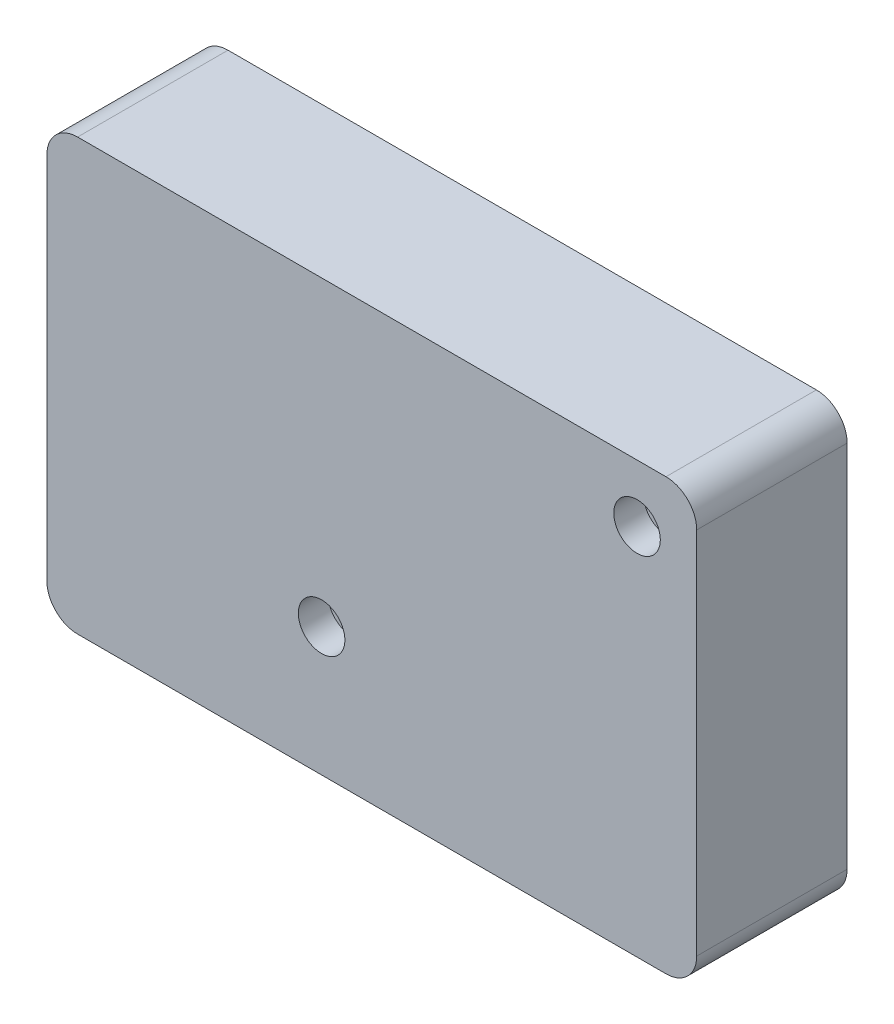
from build123d import *

# Parameters (mm, degrees)
EXTRUDE_1_DEPTH                 = 15
SHELL_1_T                       = 2.5
SKETCH_5_R                      = 4.191
EXTRUDE_2_DEPTH                 = 2.5
CUT_EXTRUDE_1_REACH             = 53.635
SKETCH_6_R                      = 2.7083489
CUT_EXTRUDE_1_DIRECTION_2_DEPTH = 1
CUT_EXTRUDE_2_DEPTH             = 52.634942496
CUT_EXTRUDE_2_DEPTH_BACK        = 52.634942496
SKETCH_7_R                      = 1.65
SKETCH_8_W                      = 11.3
SKETCH_8_H                      = 11.108258221
CUT_EXTRUDE_3_DEPTH             = 3


with BuildPart() as part:
    # 草图4 → 凸台-拉伸1 (new body)
    with BuildSketch(Plane.XY):
        with BuildLine():
            Line((32.164875784, -18.408833444), (-36.295124216, -18.408833444))
            ThreePointArc((-36.295124216, -18.408833444), (-37.055264006, -18.093973234), (-37.370124216, -17.333833444))
            Line((-37.370124216, -17.333833444), (-37.370124216, 25.606166556))
            ThreePointArc((-37.370124216, 25.606166556), (-37.055264006, 26.366306345), (-36.295124216, 26.681166556))
            Line((-36.295124216, 26.681166556), (32.164875784, 26.681166556))
            ThreePointArc((32.164875784, 26.681166556), (32.925015574, 26.366306345), (33.239875784, 25.606166556))
            Line((33.239875784, 25.606166556), (33.239875784, -17.333833444))
            ThreePointArc((33.239875784, -17.333833444), (32.925015574, -18.093973234), (32.164875784, -18.408833444))
        make_face()
    extrude(amount=-EXTRUDE_1_DEPTH)

    # 抽壳1
    shell_1_openings = [part.faces().sort_by_distance(p)[0] for p in [
        (-2.065124216, 4.136166556, -15),
    ]]
    offset(amount=SHELL_1_T, openings=shell_1_openings, kind=Kind.INTERSECTION)

    # 草图5 → 凸台-拉伸2 (add)
    with BuildSketch(Plane(origin=(0, 0, 0), x_dir=(-1, 0, 0), z_dir=(0, 0, -1))):
        with Locations(Location((-28.796875784, 22.485238556, 0), (0, 0, 180))):
            Circle(SKETCH_5_R)
        with Locations(Location((7.906124216, -5.962761444, 0), (0, 0, 180))):
            Circle(SKETCH_5_R)
    extrude(amount=EXTRUDE_2_DEPTH)

    # 草图6 → 切除-拉伸1 (cut, up to next)
    with BuildSketch(Plane(origin=(0, 0, 0), x_dir=(-1, 0, 0), z_dir=(0, 0, -1)), mode=Mode.PRIVATE) as cut_extrude_1_sk1:
        with Locations(Location((7.906124216, -5.962761444, 0), (0, 0, 180))):
            Circle(SKETCH_6_R)
    cut_extrude_1_tool1 = extrude(cut_extrude_1_sk1.sketch, amount=-CUT_EXTRUDE_1_REACH, mode=Mode.PRIVATE) & part.part
    # 草图6 → 切除-拉伸1 (cut, up to next)
    with BuildSketch(Plane(origin=(0, 0, 0), x_dir=(-1, 0, 0), z_dir=(0, 0, -1)), mode=Mode.PRIVATE) as cut_extrude_1_sk2:
        with Locations(Location((-28.796875784, 22.485238556, 0), (0, 0, 180))):
            Circle(SKETCH_6_R)
    cut_extrude_1_tool2 = extrude(cut_extrude_1_sk2.sketch, amount=-CUT_EXTRUDE_1_REACH, mode=Mode.PRIVATE) & part.part
    add(cut_extrude_1_tool1.solids().sort_by_distance((-7.906124, -5.962761, 0))[0], mode=Mode.SUBTRACT)
    add(cut_extrude_1_tool2.solids().sort_by_distance((28.796876, 22.485239, 0))[0], mode=Mode.SUBTRACT)

    # 草图6 → 切除-拉伸1 direction 2 (cut)
    with BuildSketch(Plane(origin=(0, 0, 0), x_dir=(-1, 0, 0), z_dir=(0, 0, -1))):
        with Locations(Location((7.906124216, -5.962761444, 0), (0, 0, 180))):
            Circle(SKETCH_6_R)
        with Locations(Location((-28.796875784, 22.485238556, 0), (0, 0, 180))):
            Circle(SKETCH_6_R)
    extrude(amount=CUT_EXTRUDE_1_DIRECTION_2_DEPTH, mode=Mode.SUBTRACT)

    # 草图7 → 切除-拉伸2 (cut, two sides: drawn at the far end of the back side and taken through both)
    with BuildSketch(Plane(origin=(0, 0, 0), x_dir=(-1, 0, 0), z_dir=(0, 0, -1)).offset(-CUT_EXTRUDE_2_DEPTH_BACK)):
        with Locations((7.906124216, -5.962761444)):
            Circle(SKETCH_7_R)
        with Locations((-28.796875784, 22.485238556)):
            Circle(SKETCH_7_R)
    extrude(amount=CUT_EXTRUDE_2_DEPTH + CUT_EXTRUDE_2_DEPTH_BACK, mode=Mode.SUBTRACT)

    # 草图8 → 切除-拉伸3 (cut)
    with BuildSketch(Plane.ZY.offset(39.870124216)):
        with Locations((-9.35, 8.830545142)):
            Rectangle(SKETCH_8_W, SKETCH_8_H)
    extrude(amount=-CUT_EXTRUDE_3_DEPTH, mode=Mode.SUBTRACT)


solid = part.part
